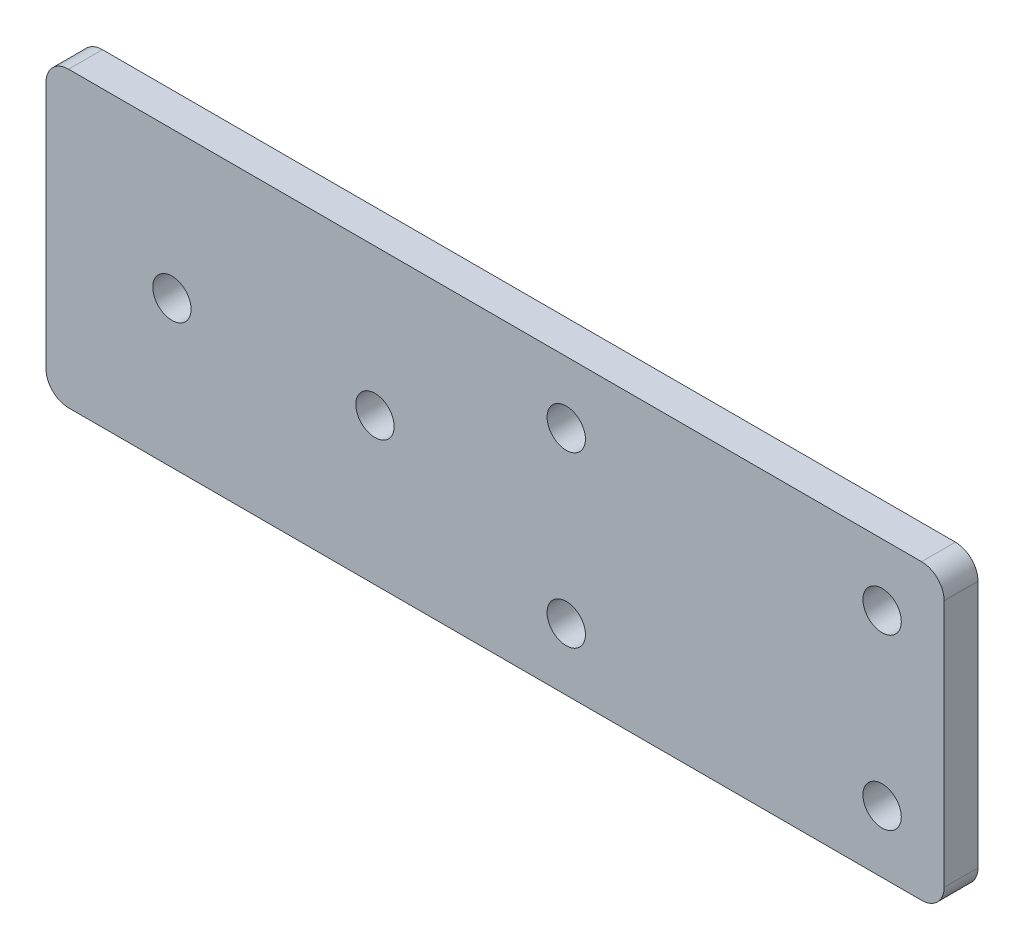
from build123d import *

# Parameters (mm, degrees)
SKETCH1_W                = 79.618258269
SKETCH1_H                = 26
BOSS_EXTRUDE1_DEPTH      = 3
M3_CLEARANCE_HOLE1_D     = 3.4
M3_CLEARANCE_HOLE1_DEPTH = 5
M3_CLEARANCE_HOLE1_TIP   = 1.021463052
M3_CLEARANCE_HOLE2_D     = 3.4
M3_CLEARANCE_HOLE2_DEPTH = 5
M3_CLEARANCE_HOLE2_TIP   = 1.021463052
FILLET1_R                = 2


with BuildPart() as part:
    # Sketch1 → Boss-Extrude1 (new body)
    with BuildSketch(Plane.XY):
        with Locations((337.690870866, 0)):
            Rectangle(SKETCH1_W, SKETCH1_H)
    extrude(amount=BOSS_EXTRUDE1_DEPTH)

    # M3 Clearance Hole1
    with Locations(Plane.XY.offset(3)):
        with Locations((372, -7.5), (372, 7.5), (344, 7.5), (344, -7.5)):
            Hole(M3_CLEARANCE_HOLE1_D / 2, depth=M3_CLEARANCE_HOLE1_DEPTH)
            with Locations((0, 0, -(M3_CLEARANCE_HOLE1_DEPTH + M3_CLEARANCE_HOLE1_TIP / 2))):  # 118° drill point
                Cone(0, M3_CLEARANCE_HOLE1_D / 2, M3_CLEARANCE_HOLE1_TIP, mode=Mode.SUBTRACT)

    # M3 Clearance Hole2
    with Locations(Plane.XY.offset(3)):
        with Locations((309.046054969, 0), (327.046054969, 0)):
            Hole(M3_CLEARANCE_HOLE2_D / 2, depth=M3_CLEARANCE_HOLE2_DEPTH)
            with Locations((0, 0, -(M3_CLEARANCE_HOLE2_DEPTH + M3_CLEARANCE_HOLE2_TIP / 2))):  # 118° drill point
                Cone(0, M3_CLEARANCE_HOLE2_D / 2, M3_CLEARANCE_HOLE2_TIP, mode=Mode.SUBTRACT)

    # Fillet1
    fillet1_edges = [part.edges().sort_by_distance(p)[0] for p in [
        (297.881741731, 13, 1.5),
        (377.5, 13, 1.5),
        (377.5, -13, 1.5),
        (297.881741731, -13, 1.5),
    ]]
    fillet(fillet1_edges, radius=FILLET1_R)


solid = part.part
